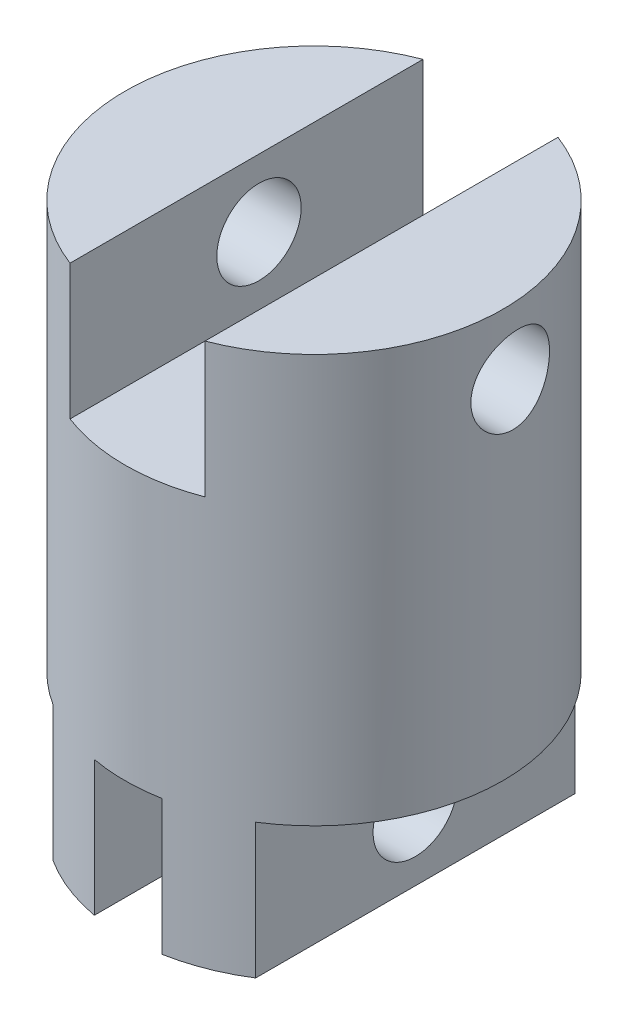
from build123d import *

# Parameters (mm, degrees)
SKETCH1_R               = 14.224
BOSS_EXTRUDE1_DEPTH     = 40.894
CUT_EXTRUDE1_START      = -10.16
CUT_EXTRUDE1_DEPTH      = 10.16
CUT_EXTRUDE2_DEPTH      = 10.16
CUT_EXTRUDE3_DEPTH      = 48.405546384
CUT_EXTRUDE3_DEPTH_BACK = 48.405546384
SKETCH4_R               = 3.175
SKETCH5_R               = 2.54
CUT_EXTRUDE4_DEPTH      = 37.731772627


with BuildPart() as part:
    # Sketch1 → Boss-Extrude1 (new body)
    with BuildSketch(Plane(origin=(0, 0, 0), x_dir=(1, 0, 0), z_dir=(0, 1, 0))):
        with Locations(Location((0, 0, 0), (0, 0, 270))):
            Circle(SKETCH1_R)
    extrude(amount=BOSS_EXTRUDE1_DEPTH)

    # Sketch2 → Cut-Extrude1 (cut)
    with BuildSketch(Plane(origin=(0, 40.894, 0), x_dir=(1, 0, 0), z_dir=(0, 1, 0)).offset(CUT_EXTRUDE1_START)):
        with BuildLine():
            Line((5.08, 13.28592398), (5.08, -13.28592398))
            ThreePointArc((5.08, -13.28592398), (0, -14.224), (-5.08, -13.28592398))
            Line((-5.08, -13.28592398), (-5.08, 13.28592398))
            ThreePointArc((-5.08, 13.28592398), (0, 14.224), (5.08, 13.28592398))
        make_face()
    extrude(amount=CUT_EXTRUDE1_DEPTH, mode=Mode.SUBTRACT)

    # Sketch3 → Cut-Extrude2 (cut)
    with BuildSketch(Plane.XZ):
        with BuildLine():
            Line((-2.54, 13.995376951), (-2.54, -13.995376951))
            ThreePointArc((-2.54, -13.995376951), (0, -14.224), (2.54, -13.995376951))
            Line((2.54, -13.995376951), (2.54, 13.995376951))
            ThreePointArc((2.54, 13.995376951), (0, 14.224), (-2.54, 13.995376951))
        make_face()
        with BuildLine():
            Line((-7.62, 12.010735864), (-7.62, -12.010735864))
            ThreePointArc((-7.62, -12.010735864), (-14.224, 0), (-7.62, 12.010735864))
        make_face()
        with BuildLine():
            Line((7.62, 12.010735864), (7.62, -12.010735864))
            ThreePointArc((7.62, -12.010735864), (14.224, 0), (7.62, 12.010735864))
        make_face()
    extrude(amount=-CUT_EXTRUDE2_DEPTH, mode=Mode.SUBTRACT)

    # Sketch4 → Cut-Extrude3 (cut, two sides: drawn at the far end of the back side and taken through both)
    with BuildSketch(Plane(origin=(-5.08, 0, 0), x_dir=(0, 0, -1), z_dir=(1, 0, 0)).offset(-CUT_EXTRUDE3_DEPTH_BACK)):
        with Locations((0.93807602, 35.814)):
            Circle(SKETCH4_R)
        with Locations((0, 5.08)):
            Circle(SKETCH4_R)
    extrude(amount=CUT_EXTRUDE3_DEPTH + CUT_EXTRUDE3_DEPTH_BACK, mode=Mode.SUBTRACT)

    # Sketch5 → Cut-Extrude4 (cut, through all)
    with BuildSketch(Plane(origin=(0, 30.734, 0), x_dir=(1, 0, 0), z_dir=(0, 1, 0))):
        with Locations(Location((0, 0, 0), (0, 0, 270))):
            Circle(SKETCH5_R)
    extrude(amount=-CUT_EXTRUDE4_DEPTH, mode=Mode.SUBTRACT)


solid = part.part
